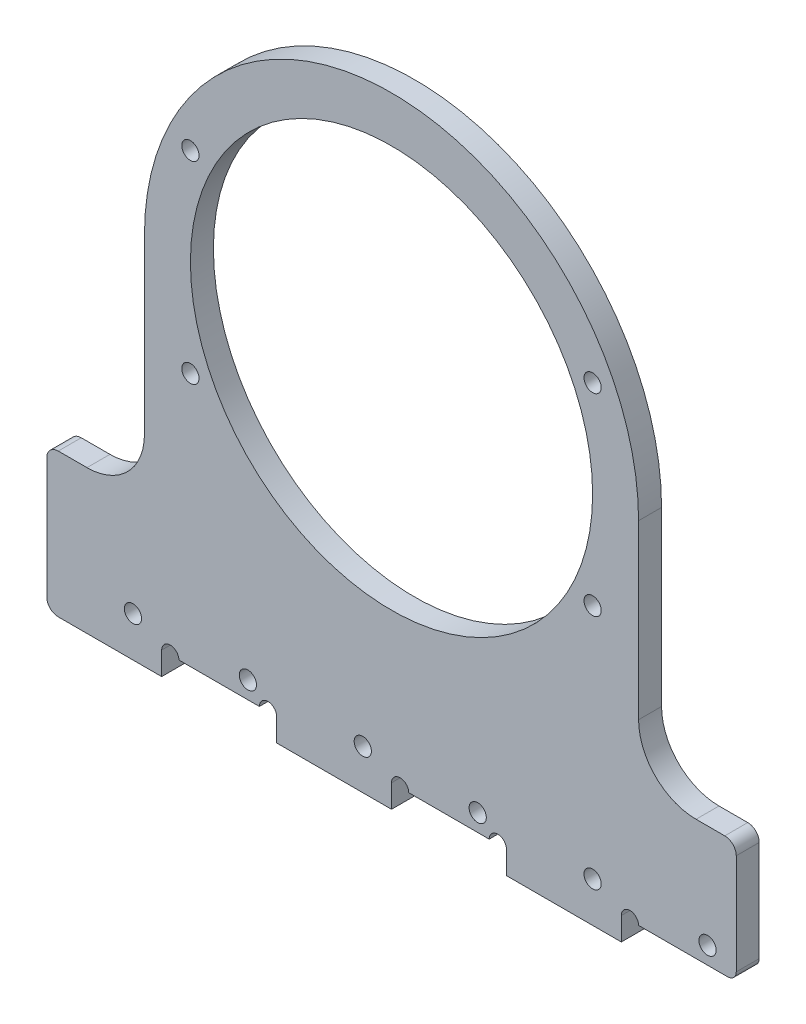
from build123d import *

# Parameters (mm, degrees)
SKETCH_1_R          = 43
SKETCH_1_R_2        = 35
EXTRUDE_1_DEPTH     = 4
SKETCH_2_R          = 1.5
CUT_EXTRUDE_1_DEPTH = 10
FILLET_1_R          = 10
FILLET_2_R          = 2
CUT_EXTRUDE_2_DEPTH = 10
FILLET_3_R          = 1.5
SKETCH_4_R          = 1.5
CUT_EXTRUDE_3_DEPTH = 4


with BuildPart() as part:
    # 草图1 → 凸台-拉伸1 (new body)
    # profile 1 of 2: a face of its own
    with BuildSketch(Plane.XY):
        Circle(SKETCH_1_R)
        Circle(SKETCH_1_R_2, mode=Mode.SUBTRACT)
    # profile 2 of 2: a face of its own
    with BuildSketch(Plane.XY):
        with BuildLine():
            ThreePointArc((43, 0), (0, -43), (-43, 0))
            Line((-43, 0), (-43, -40))
            Line((-43, -40), (-60, -40))
            Line((-60, -40), (-60, -65))
            Line((-60, -65), (60, -65))
            Line((60, -65), (60, -40))
            Line((60, -40), (43, -40))
            Line((43, -40), (43, 0))
        make_face()
    extrude(amount=EXTRUDE_1_DEPTH)

    # 草图2 → 切除-拉伸1 (cut)
    with BuildSketch(Plane.XY.offset(4)):
        with Locations((-35, 16.8)):
            Circle(SKETCH_2_R)
        with Locations((-35, -16.8)):
            Circle(SKETCH_2_R)
        with Locations((35, -16.8)):
            Circle(SKETCH_2_R)
        with Locations((35, 16.8)):
            Circle(SKETCH_2_R)
    extrude(amount=-CUT_EXTRUDE_1_DEPTH, mode=Mode.SUBTRACT)

    # 圆角1
    fillet_1_edges = [part.edges().sort_by_distance(p)[0] for p in [
        (43, -40, 2),
        (-43, -40, 2),
    ]]
    fillet(fillet_1_edges, radius=FILLET_1_R)

    # 圆角2
    fillet_2_edges = [part.edges().sort_by_distance(p)[0] for p in [
        (60, -40, 2),
        (60, -65, 2),
        (-60, -65, 2),
        (-60, -40, 2),
    ]]
    fillet(fillet_2_edges, radius=FILLET_2_R)

    # 草图3 → 切除-拉伸2 (cut)
    with BuildSketch(Plane.XY.offset(4)):
        Polygon((-40, -61), (-40, -65), (-20, -65), (-20, -61), (-23, -61), (-37, -61), align=None)
        with BuildLine():
            ThreePointArc((-37, -61), (-38.5, -59.5), (-40, -61))
            Line((-40, -61), (-37, -61))
        make_face()
        with BuildLine():
            Line((-23, -61), (-20, -61))
            ThreePointArc((-20, -61), (-21.5, -59.5), (-23, -61))
        make_face()
        with BuildLine():
            ThreePointArc((3, -61), (1.5, -59.5), (0, -61))
            Line((0, -61), (3, -61))
        make_face()
        Polygon((0, -61), (0, -65), (20, -65), (20, -61), (17, -61), (3, -61), align=None)
        with BuildLine():
            Line((17, -61), (20, -61))
            ThreePointArc((20, -61), (18.5, -59.5), (17, -61))
        make_face()
        with BuildLine():
            ThreePointArc((43, -61), (41.5, -59.5), (40, -61))
            Line((40, -61), (43, -61))
        make_face()
        with BuildLine():
            Line((40, -61), (40, -65))
            Line((40, -65), (58, -65))
            ThreePointArc((58, -65), (59.414213562, -64.414213562), (60, -63))
            Line((60, -63), (60, -61))
            Line((60, -61), (43, -61))
            Line((43, -61), (40, -61))
        make_face()
    extrude(amount=-CUT_EXTRUDE_2_DEPTH, mode=Mode.SUBTRACT)

    # 圆角3
    fillet_3_edges = [part.edges().sort_by_distance(p)[0] for p in [
        (60, -61, 2),
    ]]
    fillet(fillet_3_edges, radius=FILLET_3_R)

    # 草图4 → 切除-拉伸3 (cut)
    with BuildSketch(Plane(origin=(0, 0, 0), x_dir=(-1, 0, 0), z_dir=(0, 0, -1))):
        with Locations((-55, -58)):
            Circle(SKETCH_4_R)
        with Locations((-35, -58)):
            Circle(SKETCH_4_R)
        with Locations((-15, -58)):
            Circle(SKETCH_4_R)
        with Locations((5, -58)):
            Circle(SKETCH_4_R)
        with Locations((25, -58)):
            Circle(SKETCH_4_R)
        with Locations((45, -58)):
            Circle(SKETCH_4_R)
    extrude(amount=-CUT_EXTRUDE_3_DEPTH, mode=Mode.SUBTRACT)


solid = part.part
